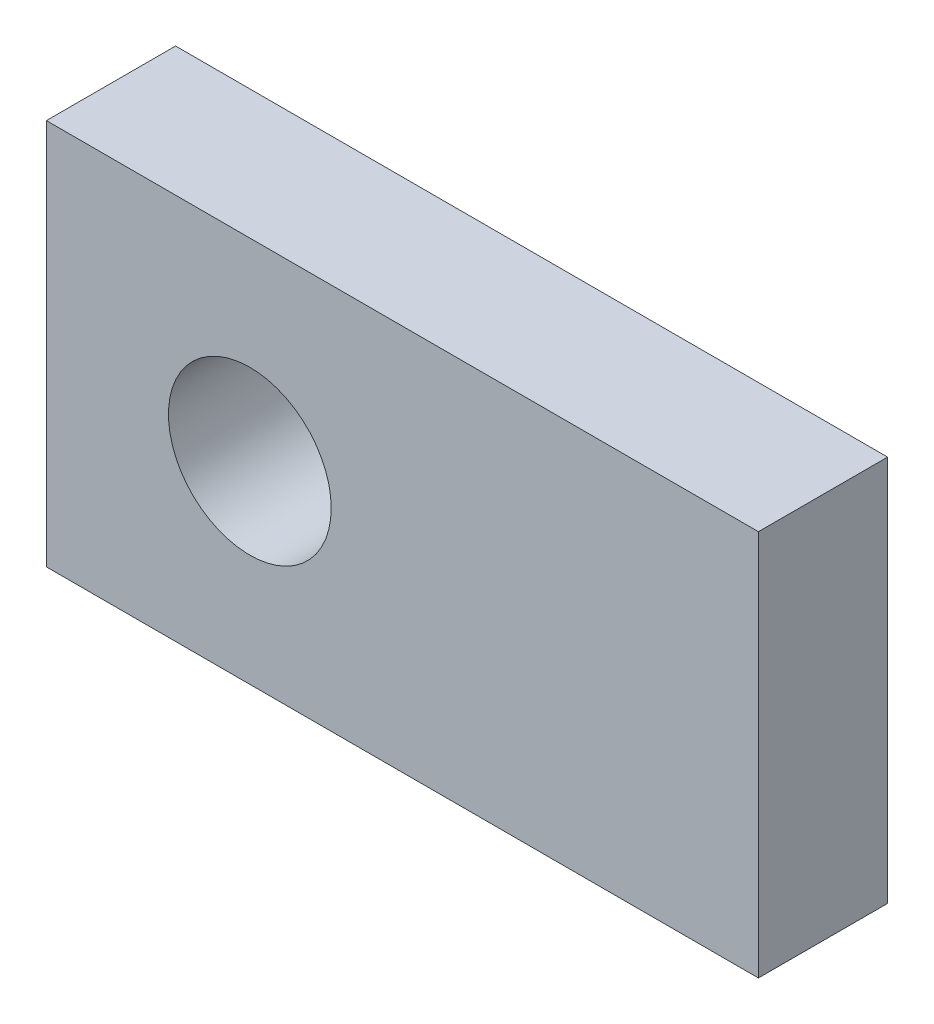
from build123d import *

# Parameters (mm, degrees)
SCHIZZO1_W                   = 35
SCHIZZO1_H                   = 19
SCHIZZO1_R                   = 4
ESTRUSIONE_ESTRUSIONE1_DEPTH = 6.35


with BuildPart() as part:
    # Schizzo1 → Estrusione-Estrusione1 (new body)
    with BuildSketch(Plane.XY):
        Rectangle(SCHIZZO1_W, SCHIZZO1_H)
        with Locations((-7.5, 0)):
            Circle(SCHIZZO1_R, mode=Mode.SUBTRACT)
    extrude(amount=ESTRUSIONE_ESTRUSIONE1_DEPTH)


solid = part.part
